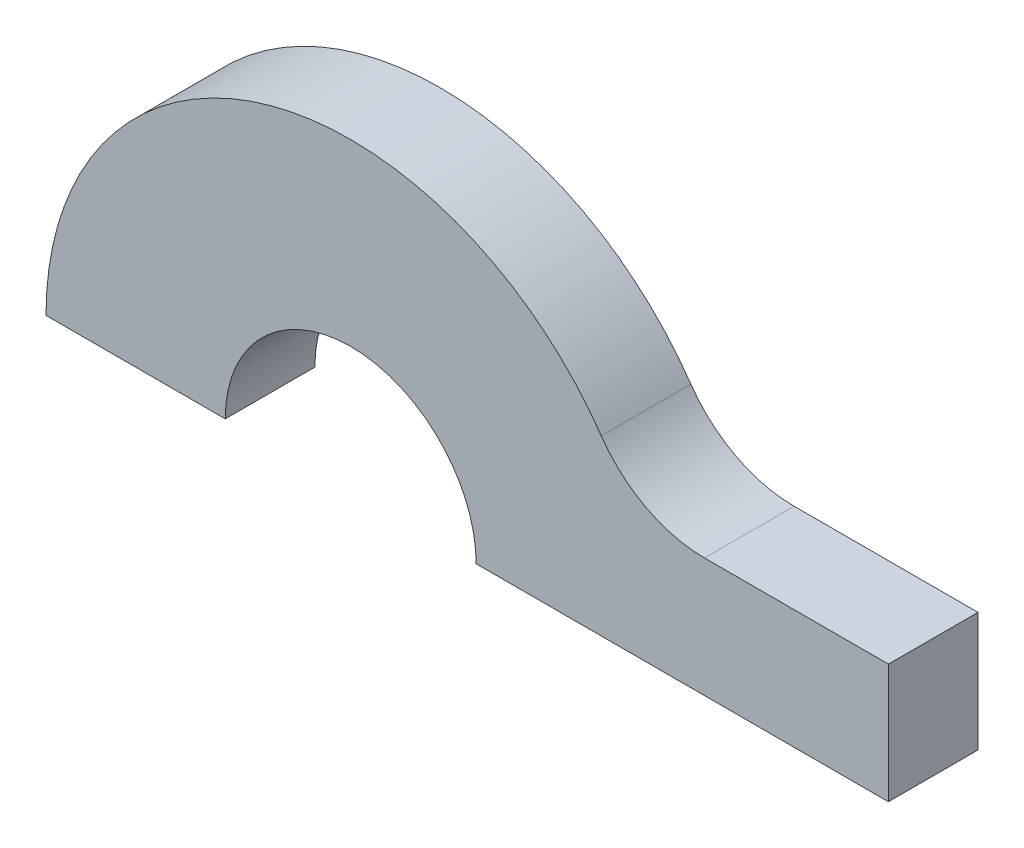
from build123d import *

# Parameters (mm, degrees)
BASE_EXTRUDE_DEPTH  = 12.7
BOSS_EXTRUDE2_START = -11.060769
SKETCH2_W           = 12.7
SKETCH2_H           = 16.891
BOSS_EXTRUDE2_DEPTH = 11.060769
SKETCH3_W           = 12.7
SKETCH3_H           = 16.891
BOSS_EXTRUDE3_DEPTH = 25.4
FILLET1_R           = 17.78


with BuildPart() as part:
    # Sketch1 → Base-Extrude (new body)
    with BuildSketch(Plane.XY):
        with BuildLine():
            Line((-43.18, 0), (-17.78, 0))
            ThreePointArc((-17.78, 0), (0, 17.78), (17.78, 0))
            Line((17.78, 0), (43.18, 0))
            ThreePointArc((43.18, 0), (0, 43.18), (-43.18, 0))
        make_face()
    extrude(amount=BASE_EXTRUDE_DEPTH)

    # Sketch2 → Boss-Extrude2 (add)
    with BuildSketch(Plane(origin=(50.8, 0, 0), x_dir=(0, 0, -1), z_dir=(1, 0, 0)).offset(BOSS_EXTRUDE2_START)):
        with Locations((-6.35, 8.4455)):
            Rectangle(SKETCH2_W, SKETCH2_H)
    extrude(amount=BOSS_EXTRUDE2_DEPTH)

    # Sketch3 → Boss-Extrude3 (add)
    with BuildSketch(Plane(origin=(50.8, 0, 0), x_dir=(0, 0, -1), z_dir=(1, 0, 0))):
        with Locations((-6.35, 8.4455)):
            Rectangle(SKETCH3_W, SKETCH3_H)
    extrude(amount=BOSS_EXTRUDE3_DEPTH)

    # Fillet1
    fillet1_edges = [part.edges().sort_by_distance(p)[0] for p in [
        (39.739231, 16.891, 6.35),
    ]]
    fillet(fillet1_edges, radius=FILLET1_R)


solid = part.part
